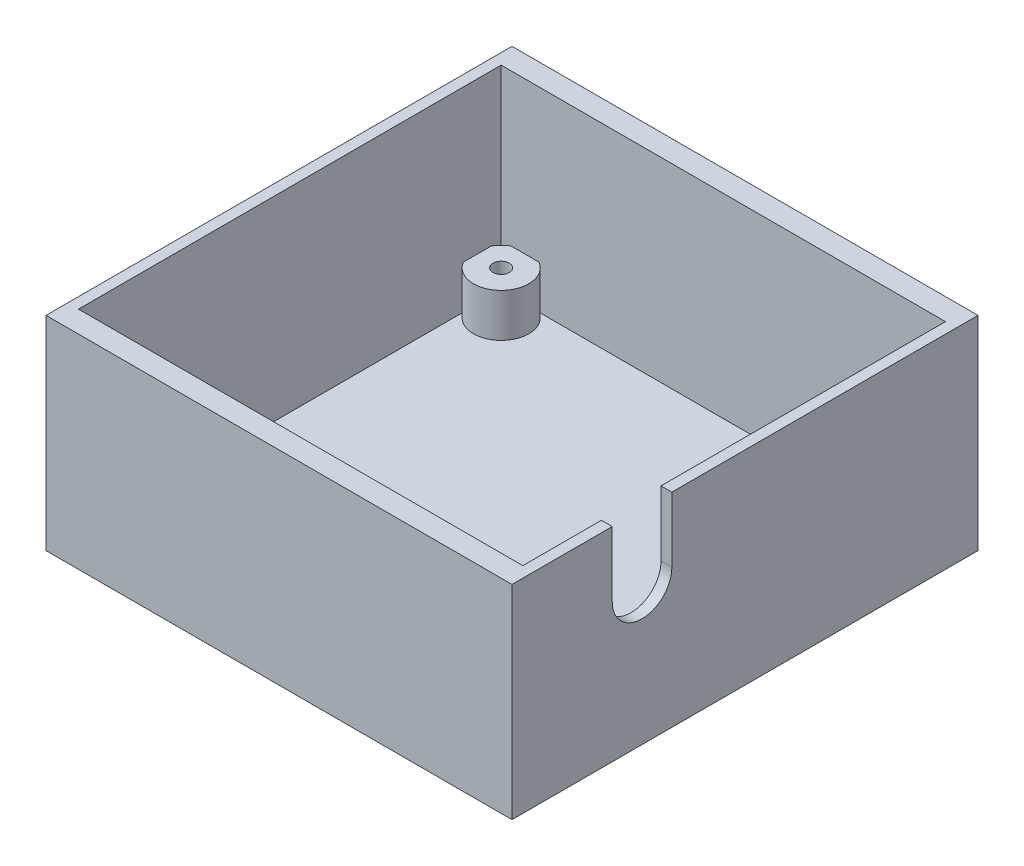
from build123d import *

# Parameters (mm, degrees)
SKETCH1_W           = 43
SKETCH1_H           = 43
SKETCH1_W_2         = 41
SKETCH1_H_2         = 39
BOSS_EXTRUDE1_DEPTH = 18
SKETCH2_W           = 43
SKETCH2_H           = 43
BOSS_EXTRUDE2_DEPTH = 0.8
SKETCH3_R           = 0.75
CUT_EXTRUDE1_DEPTH  = 10.8
BOSS_EXTRUDE3_START = 4
SKETCH4_R           = 2.55
SKETCH4_R_2         = 0.75
BOSS_EXTRUDE3_DEPTH = 4
CUT_EXTRUDE2_DEPTH  = 4


with BuildPart() as part:
    # Sketch1 → Boss-Extrude1 (new body)
    with BuildSketch(Plane(origin=(0, 0, 0), x_dir=(1, 0, 0), z_dir=(0, 1, 0))):
        Rectangle(SKETCH1_W, SKETCH1_H)
        Rectangle(SKETCH1_W_2, SKETCH1_H_2, mode=Mode.SUBTRACT)
    extrude(amount=BOSS_EXTRUDE1_DEPTH)

    # Sketch2 → Boss-Extrude2 (add)
    with BuildSketch(Plane.XZ):
        Rectangle(SKETCH2_W, SKETCH2_H)
    extrude(amount=BOSS_EXTRUDE2_DEPTH)

    # Sketch3 → Cut-Extrude1 (cut)
    with BuildSketch(Plane(origin=(0, 0, 0), x_dir=(1, 0, 0), z_dir=(0, 1, 0))):
        with Locations(Location((18.3, 17.3, 0), (0, 0, 270))):
            Circle(SKETCH3_R)
        with Locations(Location((-18.3, 17.3, 0), (0, 0, 270))):
            Circle(SKETCH3_R)
        with Locations(Location((-18.3, -17.3, 0), (0, 0, 270))):
            Circle(SKETCH3_R)
        with Locations(Location((18.3, -17.3, 0), (0, 0, 270))):
            Circle(SKETCH3_R)
    extrude(amount=-CUT_EXTRUDE1_DEPTH, mode=Mode.SUBTRACT)

    # Sketch4 → Boss-Extrude3 (add)
    # profile 1 of 4: a face of its own
    with BuildSketch(Plane(origin=(0, 0, 0), x_dir=(1, 0, 0), z_dir=(0, 1, 0)).offset(BOSS_EXTRUDE3_START)):
        with Locations((-18.3, 17.3)):
            Circle(SKETCH4_R)
        with Locations(Location((-18.3, 17.3, 0), (0, 0, 270))):
            Circle(SKETCH4_R_2, mode=Mode.SUBTRACT)
    # profile 2 of 4: a face of its own
    with BuildSketch(Plane(origin=(0, 0, 0), x_dir=(1, 0, 0), z_dir=(0, 1, 0)).offset(BOSS_EXTRUDE3_START)):
        with Locations((18.3, 17.3)):
            Circle(SKETCH4_R)
        with Locations(Location((18.3, 17.3, 0), (0, 0, 270))):
            Circle(SKETCH4_R_2, mode=Mode.SUBTRACT)
    # profile 3 of 4: a face of its own
    with BuildSketch(Plane(origin=(0, 0, 0), x_dir=(1, 0, 0), z_dir=(0, 1, 0)).offset(BOSS_EXTRUDE3_START)):
        with Locations((18.3, -17.3)):
            Circle(SKETCH4_R)
        with Locations(Location((18.3, -17.3, 0), (0, 0, 270))):
            Circle(SKETCH4_R_2, mode=Mode.SUBTRACT)
    # profile 4 of 4: a face of its own
    with BuildSketch(Plane(origin=(0, 0, 0), x_dir=(1, 0, 0), z_dir=(0, 1, 0)).offset(BOSS_EXTRUDE3_START)):
        with Locations((-18.3, -17.3)):
            Circle(SKETCH4_R)
        with Locations(Location((-18.3, -17.3, 0), (0, 0, 270))):
            Circle(SKETCH4_R_2, mode=Mode.SUBTRACT)
    extrude(amount=-BOSS_EXTRUDE3_DEPTH)

    # Sketch5 → Cut-Extrude2 (cut)
    with BuildSketch(Plane(origin=(21.5, 0, 0), x_dir=(0, 0, -1), z_dir=(1, 0, 0))):
        with BuildLine():
            Line((-12.25, 12), (-12.25, 18))
            Line((-12.25, 18), (-6.75, 18))
            Line((-6.75, 18), (-6.75, 12))
            ThreePointArc((-6.75, 12), (-9.5, 9.25), (-12.25, 12))
        make_face()
    extrude(amount=-CUT_EXTRUDE2_DEPTH, mode=Mode.SUBTRACT)


solid = part.part
